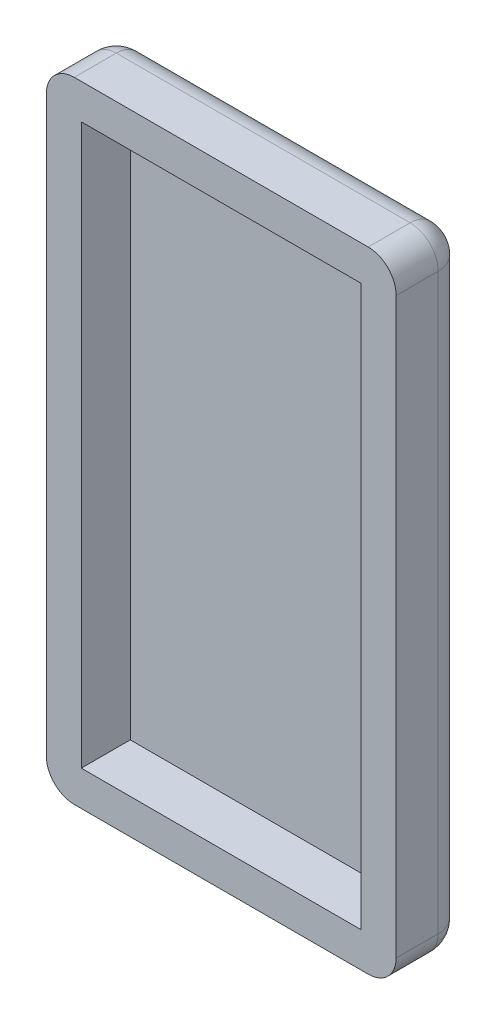
from build123d import *

# Parameters (mm, degrees)
IZIM1_W                     = 25
IZIM1_H                     = 45
Y_KSEKLIK_EKSTR_ZYON1_DEPTH = 5
IZIM2_W                     = 20
IZIM2_H                     = 40
KES_EKSTR_ZYON1_DEPTH       = 3.5
RADYUS1_R                   = 2


with BuildPart() as part:
    # Çizim1 → Yükseklik-Ekstrüzyon1 (new body)
    with BuildSketch(Plane.XY.offset(5)):
        with Locations((-0.661993769, -16.705607477)):
            Rectangle(IZIM1_W, IZIM1_H)
    extrude(amount=-Y_KSEKLIK_EKSTR_ZYON1_DEPTH)

    # Çizim2 → Kes-Ekstrüzyon1 (cut)
    with BuildSketch(Plane.XY.offset(5)):
        with Locations((-0.661993769, -16.705607477)):
            Rectangle(IZIM2_W, IZIM2_H)
    extrude(amount=-KES_EKSTR_ZYON1_DEPTH, mode=Mode.SUBTRACT)

    # Radyus1
    radyus1_edges = [part.edges().sort_by_distance(p)[0] for p in [
        (11.838006231, -16.705607477, 0),
        (-0.661993769, 5.794392523, 0),
        (-13.161993769, -16.705607477, 0),
        (-13.161993769, 5.794392523, 2.5),
        (11.838006231, 5.794392523, 2.5),
        (11.838006231, -39.205607477, 2.5),
        (-13.161993769, -39.205607477, 2.5),
        (-0.661993769, -39.205607477, 0),
    ]]
    fillet(radyus1_edges, radius=RADYUS1_R)


solid = part.part
